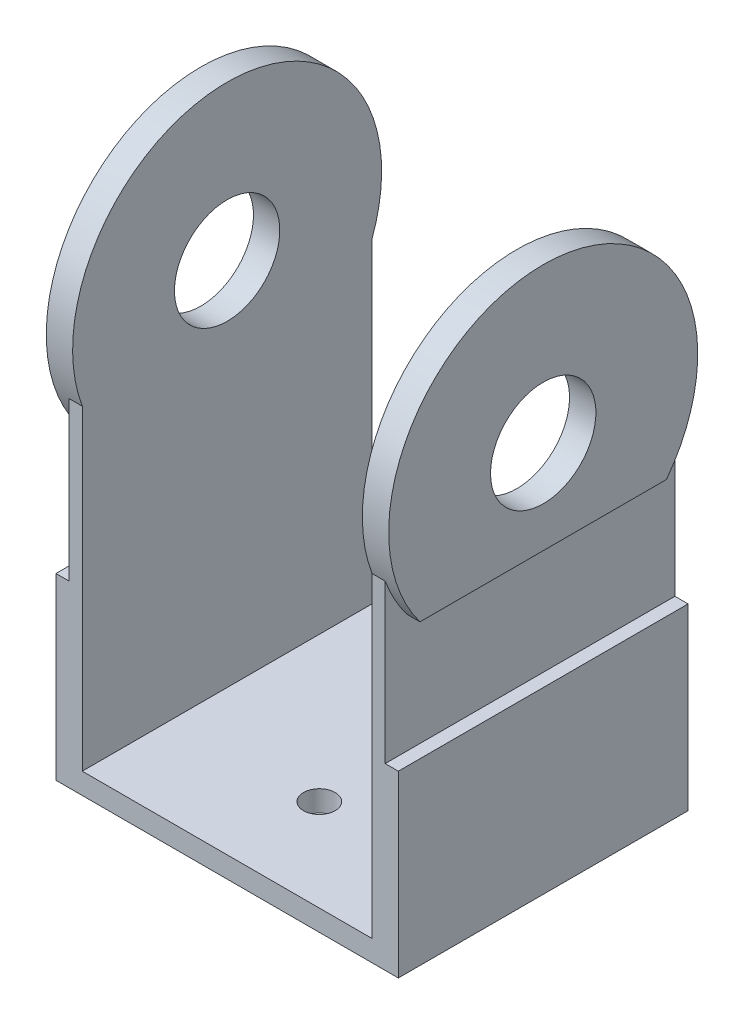
from build123d import *

# Parameters (mm, degrees)
SKETCH1_W                = 65
SKETCH1_H                = 55
BOSS_EXTRUDE1_DEPTH      = 4
SKETCH2_W                = 2.5
SKETCH2_H                = 55
BOSS_EXTRUDE2_DEPTH      = 60
SKETCH2_3_W              = 2.5
SKETCH2_3_H              = 55
BOSS_EXTRUDE3_DEPTH      = 30
BOSS_EXTRUDE4_DEPTH      = 2.5
BOSS_EXTRUDE4_DEPTH_BACK = 2.5
SKETCH4_R                = 10
BOSS_EXTRUDE5_START      = -62.5
SKETCH4_2_R              = 10
BOSS_EXTRUDE5_DEPTH      = 5
CUT_EXTRUDE1_DEPTH       = 113.403083271
CUT_EXTRUDE1_DEPTH_BACK  = 113.403083271
SKETCH5_R                = 3


with BuildPart() as part:
    # Sketch1 → Boss-Extrude1 (new body)
    with BuildSketch(Plane(origin=(0, 0, 0), x_dir=(1, 0, 0), z_dir=(0, 1, 0))):
        Rectangle(SKETCH1_W, SKETCH1_H)
    extrude(amount=BOSS_EXTRUDE1_DEPTH)

    # Sketch2 → Boss-Extrude2 (add)
    with BuildSketch(Plane(origin=(0, 4, 0), x_dir=(1, 0, 0), z_dir=(0, 1, 0))):
        with Locations((-28.75, 0)):
            Rectangle(SKETCH2_W, SKETCH2_H)
        with Locations((28.75, 0)):
            Rectangle(SKETCH2_W, SKETCH2_H)
    extrude(amount=BOSS_EXTRUDE2_DEPTH)

    # Sketch2<3> → Boss-Extrude3 (add)
    with BuildSketch(Plane(origin=(0, 4, 0), x_dir=(1, 0, 0), z_dir=(0, 1, 0))):
        with Locations((-31.25, 0)):
            Rectangle(SKETCH2_3_W, SKETCH2_3_H)
        with Locations((31.25, 0)):
            Rectangle(SKETCH2_3_W, SKETCH2_3_H)
    extrude(amount=BOSS_EXTRUDE3_DEPTH)

    # Sketch4 → Boss-Extrude4 (add, two sides: drawn at the far end of the back side and taken through both)
    with BuildSketch(Plane.ZY.offset(30).offset(-BOSS_EXTRUDE4_DEPTH_BACK)):
        with BuildLine():
            Line((23.388987302, 56.500283138), (-23.388987302, 56.500283138))
            ThreePointArc((-23.388987302, 56.500283138), (0, 103.527582425), (23.388987302, 56.500283138))
        make_face()
        with Locations((0, 74.19768631)):
            Circle(SKETCH4_R, mode=Mode.SUBTRACT)
    extrude(amount=BOSS_EXTRUDE4_DEPTH + BOSS_EXTRUDE4_DEPTH_BACK)

    # Sketch4<2> → Boss-Extrude5 (add)
    with BuildSketch(Plane.ZY.offset(30).offset(BOSS_EXTRUDE5_START)):
        with BuildLine():
            Line((23.388987302, 56.500283138), (-23.388987302, 56.500283138))
            ThreePointArc((-23.388987302, 56.500283138), (0, 103.527582425), (23.388987302, 56.500283138))
        make_face()
        with Locations((0, 74.19768631)):
            Circle(SKETCH4_2_R, mode=Mode.SUBTRACT)
    extrude(amount=BOSS_EXTRUDE5_DEPTH)

    # Sketch5 → Cut-Extrude1 (cut, two sides: drawn at the far end of the back side and taken through both)
    with BuildSketch(Plane.XZ.offset(-CUT_EXTRUDE1_DEPTH_BACK)):
        with Locations((0, 10)):
            Circle(SKETCH5_R)
        with Locations((0, -10)):
            Circle(SKETCH5_R)
    extrude(amount=CUT_EXTRUDE1_DEPTH + CUT_EXTRUDE1_DEPTH_BACK, mode=Mode.SUBTRACT)


solid = part.part
